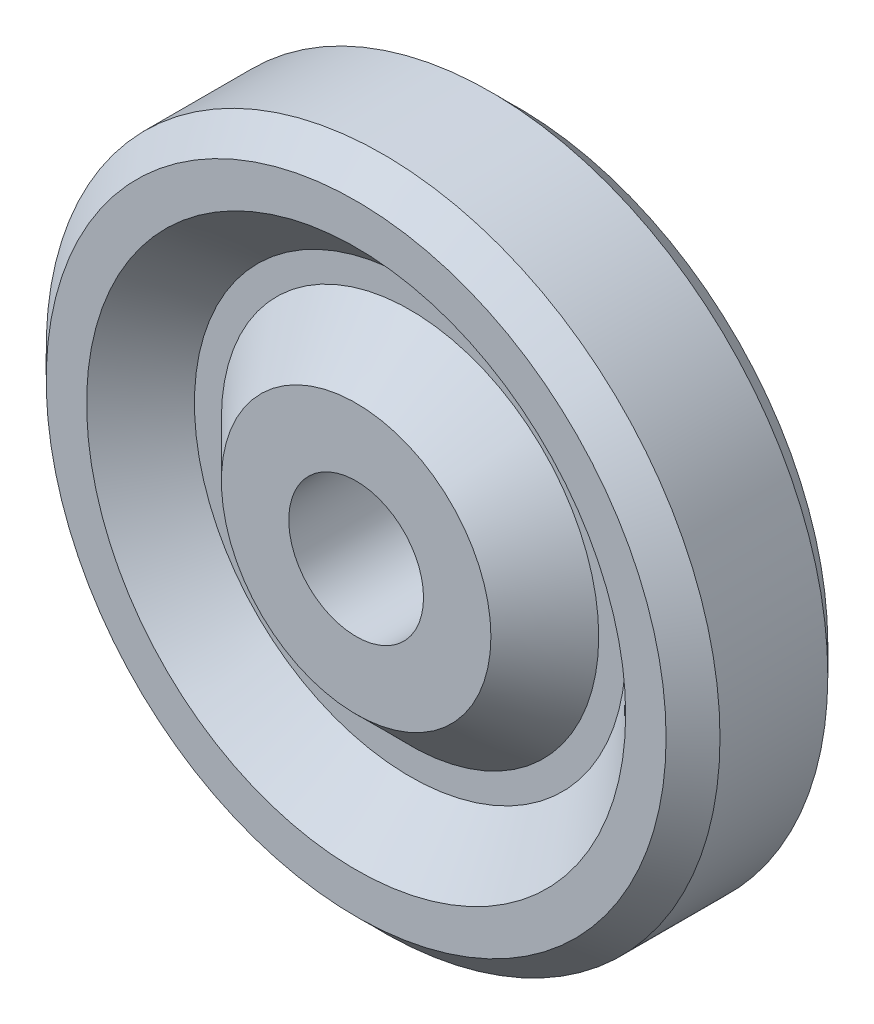
from build123d import *

# Parameters (mm, degrees)
SKETCH2_R                 = 12.5
BOSS_EXTRUDE1_DEPTH       = 3
SKETCH3_R                 = 2.5
CUT_EXTRUDE1_DEPTH        = 6
SKETCH4_R                 = 10
SKETCH4_R_2               = 5
CUT_EXTRUDE2_DEPTH        = 2
CUT_EXTRUDE2_DRAFT        = -45
MIRROR1_COPY_1_SKETCH_R   = 10
MIRROR1_COPY_1_SKETCH_R_2 = 5
MIRROR1_COPY_1_DEPTH      = 2
MIRROR1_COPY_1_DRAFT      = -45
CHAMFER1_SIZE             = 1


with BuildPart() as part:
    # Sketch2 → Boss-Extrude1 (new, symmetric)
    with BuildSketch(Plane.XY):
        Circle(SKETCH2_R)
    extrude(amount=BOSS_EXTRUDE1_DEPTH, both=True)

    # Sketch3 → Cut-Extrude1 (cut)
    with BuildSketch(Plane.XY.offset(3)):
        Circle(SKETCH3_R)
    extrude(amount=-CUT_EXTRUDE1_DEPTH, mode=Mode.SUBTRACT)


with BuildPart() as cut_extrude2_tool:
    # Sketch4 → Cut-Extrude2 (with draft: the straight prism first)
    with BuildSketch(Plane.XY.offset(3)):
        Circle(SKETCH4_R)
        Circle(SKETCH4_R_2, mode=Mode.SUBTRACT)
    extrude(amount=-CUT_EXTRUDE2_DEPTH)
    # Cut-Extrude2: the draft: its side faces are tilted about the plane it starts from
    cut_extrude2_sides = [cut_extrude2_tool.faces().sort_by_distance(p)[0] for p in [
        (-10, 0, 2),
        (-5, 0, 2),
    ]]
    draft(cut_extrude2_sides, Plane.XY.offset(3), CUT_EXTRUDE2_DRAFT)


with BuildPart() as part_1:
    add(part.part)

    # Cut-Extrude2: cut by cut_extrude2_tool
    add(cut_extrude2_tool.part, mode=Mode.SUBTRACT)


with BuildPart() as mirror1_copy_1_tool:
    # Mirror1 copy 1 sketch → Mirror1 copy 1 (with draft: the straight prism first)
    with BuildSketch(Plane(origin=(0, 0, -3), x_dir=(1, 0, 0), z_dir=(0, 0, -1))):
        Circle(MIRROR1_COPY_1_SKETCH_R)
        Circle(MIRROR1_COPY_1_SKETCH_R_2, mode=Mode.SUBTRACT)
    extrude(amount=-MIRROR1_COPY_1_DEPTH)
    # Mirror1 copy 1: the draft: its side faces are tilted about the plane it starts from
    mirror1_copy_1_sides = [mirror1_copy_1_tool.faces().sort_by_distance(p)[0] for p in [
        (-10, 0, -2),
        (-5, 0, -2),
    ]]
    draft(mirror1_copy_1_sides, Plane(origin=(0, 0, -3), x_dir=(1, 0, 0), z_dir=(0, 0, -1)), MIRROR1_COPY_1_DRAFT)


with BuildPart() as part_2:
    add(part_1.part)

    # Mirror1 copy 1: cut by mirror1_copy_1_tool
    add(mirror1_copy_1_tool.part, mode=Mode.SUBTRACT)

    # Chamfer1
    chamfer1_edges = [part_2.edges().sort_by_distance(p)[0] for p in [
        (-12.5, 0, -3),
        (-12.5, 0, 3),
    ]]
    chamfer(chamfer1_edges, length=CHAMFER1_SIZE)


solid = part_2.part
